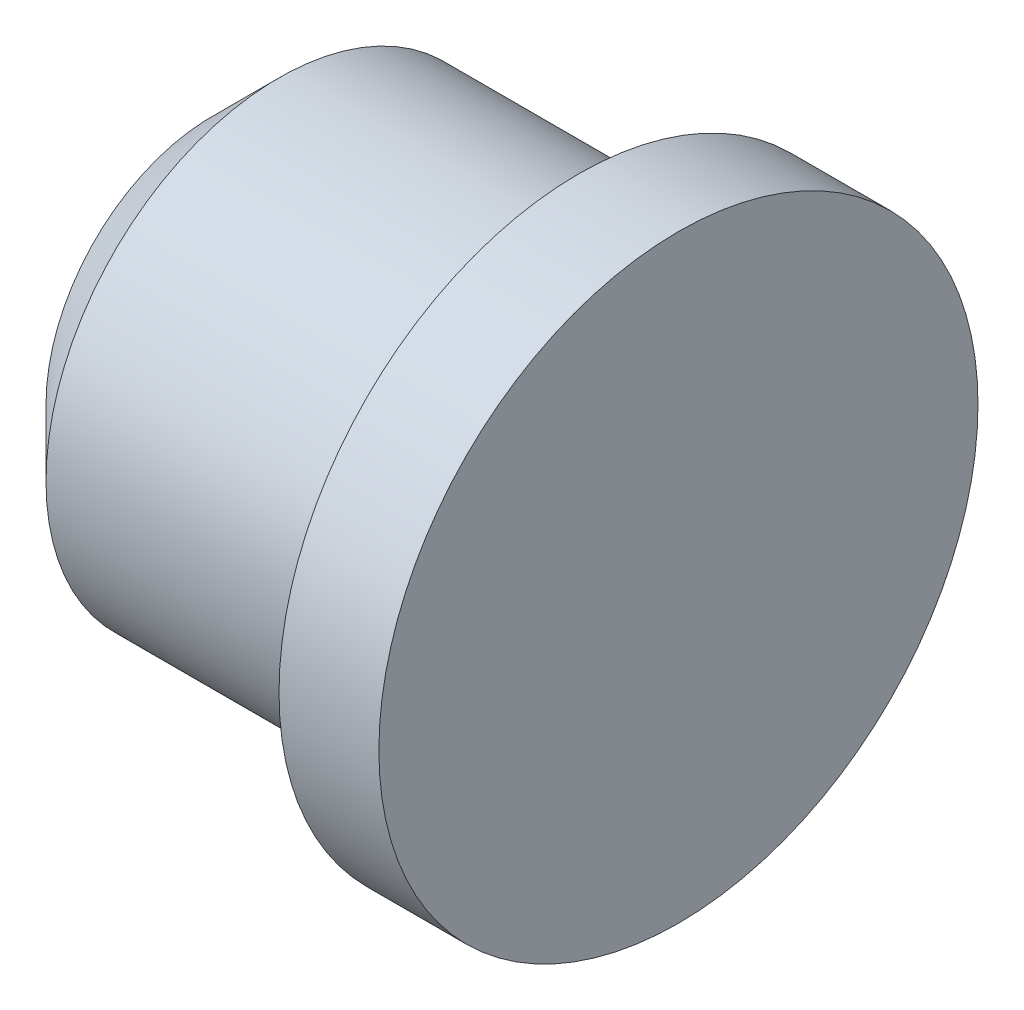
from build123d import *

# Parameters (mm, degrees)
CHANFREIN1_SIZE = 0.5


with BuildPart() as part:
    # Esquisse1 → Base-Révolution (revolve)
    with BuildSketch(Plane.XY, mode=Mode.PRIVATE) as base_r_volution_sk:
        Polygon((8, 10.75), (5.25, 10.75), (5.25, 9), (8.75, 9), (8.75, 11.25), (8, 11.25), align=None)
    revolve(base_r_volution_sk.sketch.rotate(Axis((11, 9, 0), (-1, 0, 0)), 90), axis=Axis((11, 9, 0), (-1, 0, 0)))

    # Chanfrein1
    chanfrein1_edges = [part.edges().sort_by_distance(p)[0] for p in [
        (5.25, 9, 1.75),
    ]]
    chamfer(chanfrein1_edges, length=CHANFREIN1_SIZE)


solid = part.part
